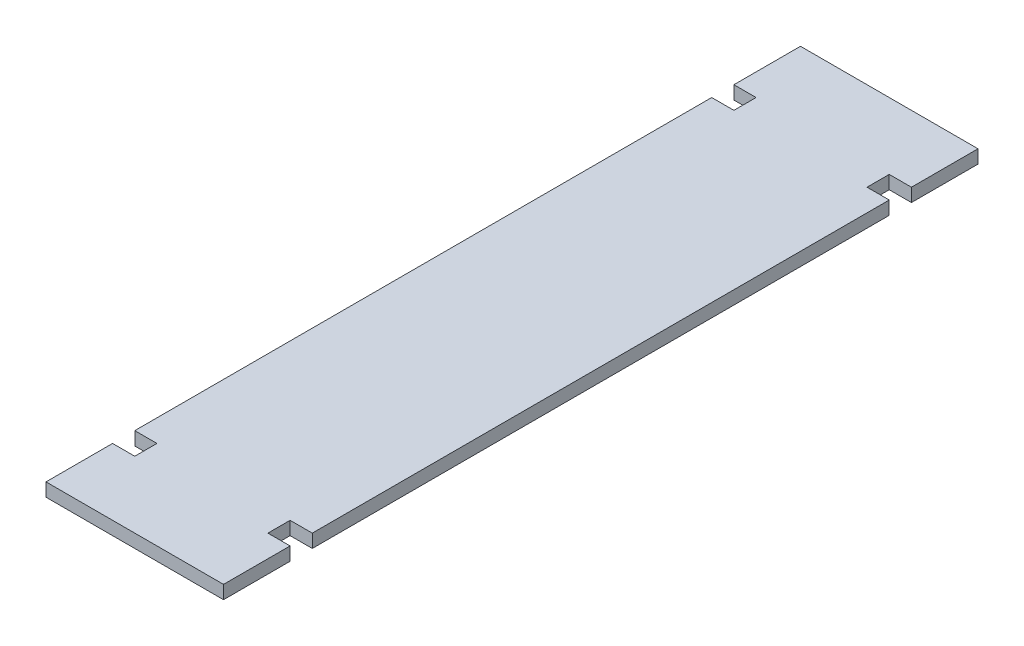
from build123d import *

# Parameters (mm, degrees)
SKETCH1_W           = 40
SKETCH1_H           = 170
BOSS_EXTRUDE1_DEPTH = 3
SKETCH2_W           = 5
SKETCH2_H           = 5
CUT_EXTRUDE1_DEPTH  = 10


with BuildPart() as part:
    # Sketch1 → Boss-Extrude1 (new body)
    with BuildSketch(Plane(origin=(0, 0, 0), x_dir=(1, 0, 0), z_dir=(0, 1, 0))):
        with Locations((20, 85)):
            Rectangle(SKETCH1_W, SKETCH1_H)
    extrude(amount=BOSS_EXTRUDE1_DEPTH)

    # Sketch2 → Cut-Extrude1 (cut)
    with BuildSketch(Plane(origin=(0, 0, 0), x_dir=(1, 0, 0), z_dir=(0, 1, 0))):
        with Locations((2.5, 152.5)):
            Rectangle(SKETCH2_W, SKETCH2_H)
        with Locations((37.5, 17.5)):
            Rectangle(SKETCH2_W, SKETCH2_H)
        with Locations((2.5, 17.5)):
            Rectangle(SKETCH2_W, SKETCH2_H)
        with Locations((37.5, 152.5)):
            Rectangle(SKETCH2_W, SKETCH2_H)
    extrude(amount=CUT_EXTRUDE1_DEPTH, mode=Mode.SUBTRACT)


solid = part.part
